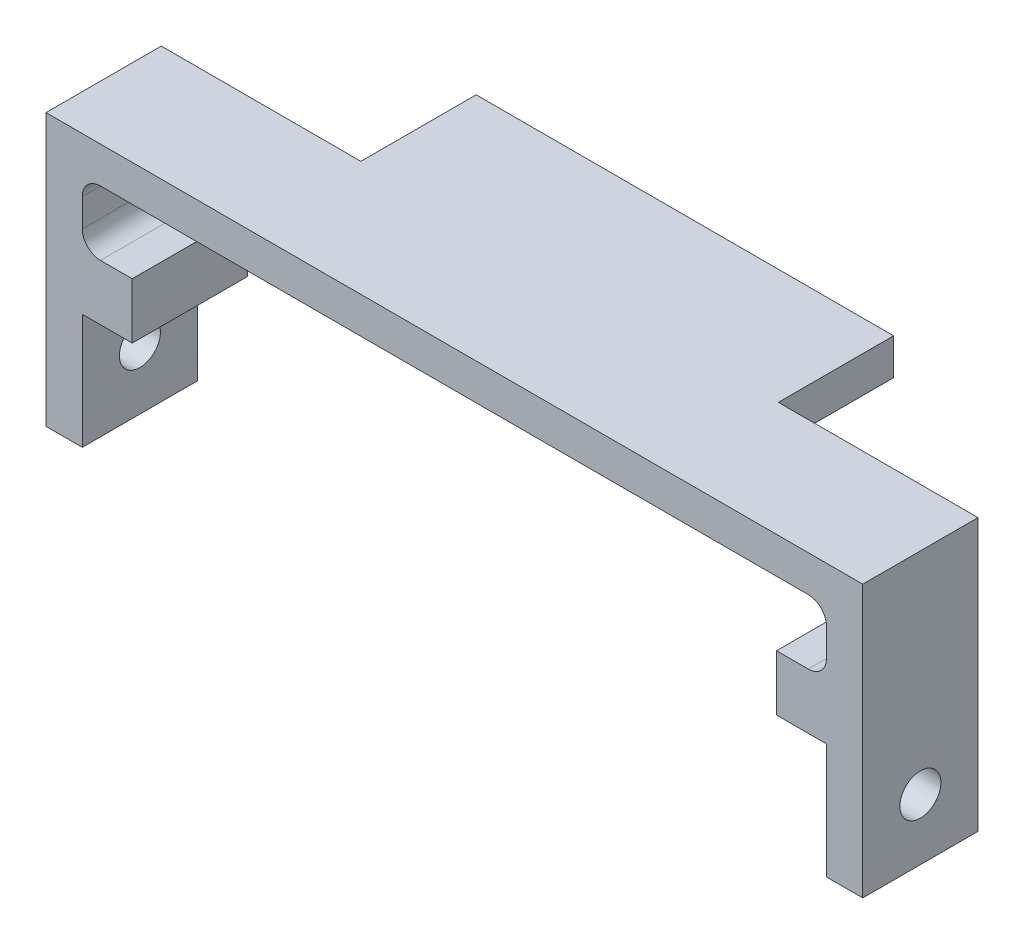
from build123d import *

# Parameters (mm, degrees)
SKETCH2_W                           = 2.75
SKETCH2_H                           = 3.07
BOSS_EXTRUDE2_DEPTH                 = 6.35
SKETCH3_W                           = 23
SKETCH3_H                           = 6.35
BOSS_EXTRUDE3_DEPTH                 = 2
F_4_40_TAPPED_HOLE1_D               = 2.2606
F_4_40_TAPPED_HOLE1_DEPTH           = 3.91
F_4_40_TAPPED_HOLE1_TIP             = 0.679152758
F_4_40_TAPPED_HOLE1_ON_FACE_2_D     = 2.2606
F_4_40_TAPPED_HOLE1_ON_FACE_2_DEPTH = 3.91
F_4_40_TAPPED_HOLE1_ON_FACE_2_TIP   = 0.679152758
FILLET1_R                           = 1


with BuildPart() as part:
    # Sketch2 → Boss-Extrude2 (new body)
    with BuildSketch(Plane.XY):
        Polygon((-3, -12.4725), (-1, -12.4725), (-1, -6.1225), (-1, -3.0525), (-1, 0.5), (40, 0.5), (40, -3.0525), (40, -6.1225), (40, -12.4725), (42, -12.4725), (42, 2.5), (-3, 2.5), align=None)
        with Locations((0.375, -4.5875)):
            Rectangle(SKETCH2_W, SKETCH2_H)
        with Locations((38.625, -4.5875)):
            Rectangle(SKETCH2_W, SKETCH2_H)
    extrude(amount=BOSS_EXTRUDE2_DEPTH)

    # Sketch3 → Boss-Extrude3 (add)
    with BuildSketch(Plane(origin=(0, 2.5, 0), x_dir=(1, 0, 0), z_dir=(0, 1, 0))):
        with Locations((19.5, 3.175)):
            Rectangle(SKETCH3_W, SKETCH3_H)
    extrude(amount=-BOSS_EXTRUDE3_DEPTH)

    # #4-40 Tapped Hole1
    with Locations(Plane(origin=(-3, -9.1225, 3.175), x_dir=(0, -1, 0), z_dir=(-1, 0, 0))):
        with Locations((0, 0)):
            Hole(F_4_40_TAPPED_HOLE1_D / 2, depth=F_4_40_TAPPED_HOLE1_DEPTH)
            with Locations((0, 0, -(F_4_40_TAPPED_HOLE1_DEPTH + F_4_40_TAPPED_HOLE1_TIP / 2))):  # 118° drill point
                Cone(0, F_4_40_TAPPED_HOLE1_D / 2, F_4_40_TAPPED_HOLE1_TIP, mode=Mode.SUBTRACT)

    # #4-40 Tapped Hole1 on face 2
    with Locations(Plane(origin=(42, -9.1225, 3.175), x_dir=(0, 0, 1), z_dir=(1, 0, 0))):
        with Locations((0, 0)):
            Hole(F_4_40_TAPPED_HOLE1_ON_FACE_2_D / 2, depth=F_4_40_TAPPED_HOLE1_ON_FACE_2_DEPTH)
            with Locations((0, 0, -(F_4_40_TAPPED_HOLE1_ON_FACE_2_DEPTH + F_4_40_TAPPED_HOLE1_ON_FACE_2_TIP / 2))):  # 118° drill point
                Cone(0, F_4_40_TAPPED_HOLE1_ON_FACE_2_D / 2, F_4_40_TAPPED_HOLE1_ON_FACE_2_TIP, mode=Mode.SUBTRACT)

    # Fillet1
    fillet1_edges = [part.edges().sort_by_distance(p)[0] for p in [
        (40, 0.5, 3.175),
        (-1, 0.5, 3.175),
        (-1, -3.0525, 3.175),
        (40, -3.0525, 3.175),
    ]]
    fillet(fillet1_edges, radius=FILLET1_R)


solid = part.part
